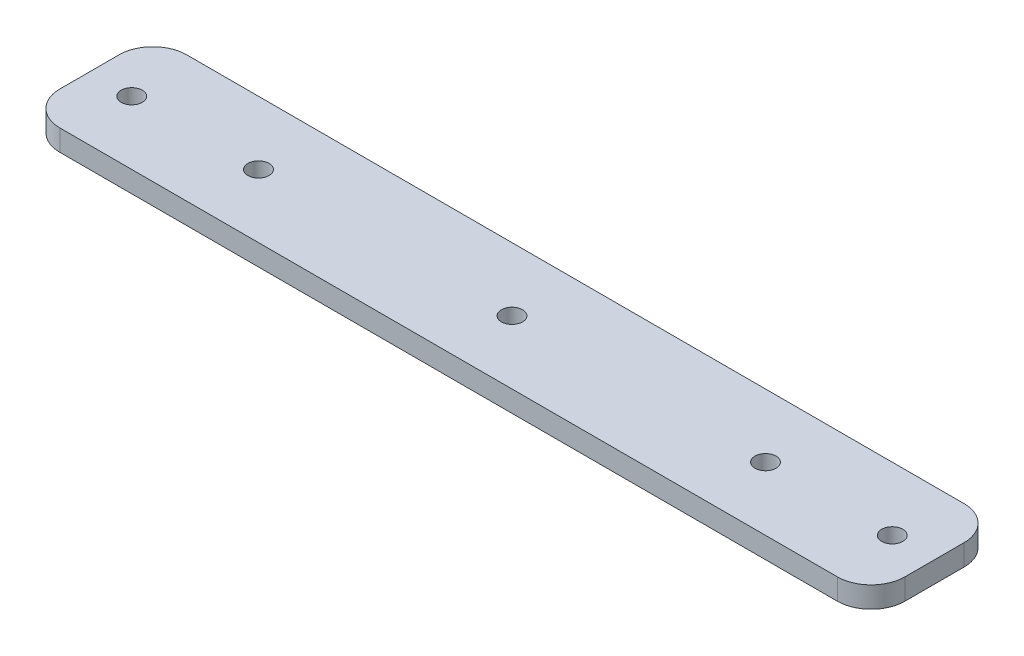
from build123d import *

# Parameters (mm, degrees)
SKETCH2_R           = 3.175
BOSS_EXTRUDE1_DEPTH = 6.35


with BuildPart() as part:
    # Sketch2 → Boss-Extrude1 (new body)
    with BuildSketch(Plane(origin=(0, 0, 0), x_dir=(1, 0, 0), z_dir=(0, 1, 0))):
        with BuildLine():
            Line((10.16, 0), (243.84, 0))
            ThreePointArc((243.84, 0), (251.024204897, -2.975795103), (254, -10.16))
            Line((254, -10.16), (254, -27.94))
            ThreePointArc((254, -27.94), (251.024204897, -35.124204897), (243.84, -38.1))
            Line((243.84, -38.1), (10.16, -38.1))
            ThreePointArc((10.16, -38.1), (2.975795103, -35.124204897), (0, -27.94))
            Line((0, -27.94), (0, -10.16))
            ThreePointArc((0, -10.16), (2.975795103, -2.975795103), (10.16, 0))
        make_face()
        with Locations(Location((12.7, -19.05, 0), (0, 0, 270))):
            Circle(SKETCH2_R, mode=Mode.SUBTRACT)
        with Locations(Location((241.3, -19.05, 0), (0, 0, 90))):
            Circle(SKETCH2_R, mode=Mode.SUBTRACT)
        with Locations(Location((50.8, -19.05, 0), (0, 0, 270))):
            Circle(SKETCH2_R, mode=Mode.SUBTRACT)
        with Locations(Location((127, -19.05, 0), (0, 0, 270))):
            Circle(SKETCH2_R, mode=Mode.SUBTRACT)
        with Locations(Location((203.2, -19.05, 0), (0, 0, 270))):
            Circle(SKETCH2_R, mode=Mode.SUBTRACT)
    extrude(amount=BOSS_EXTRUDE1_DEPTH)


solid = part.part
